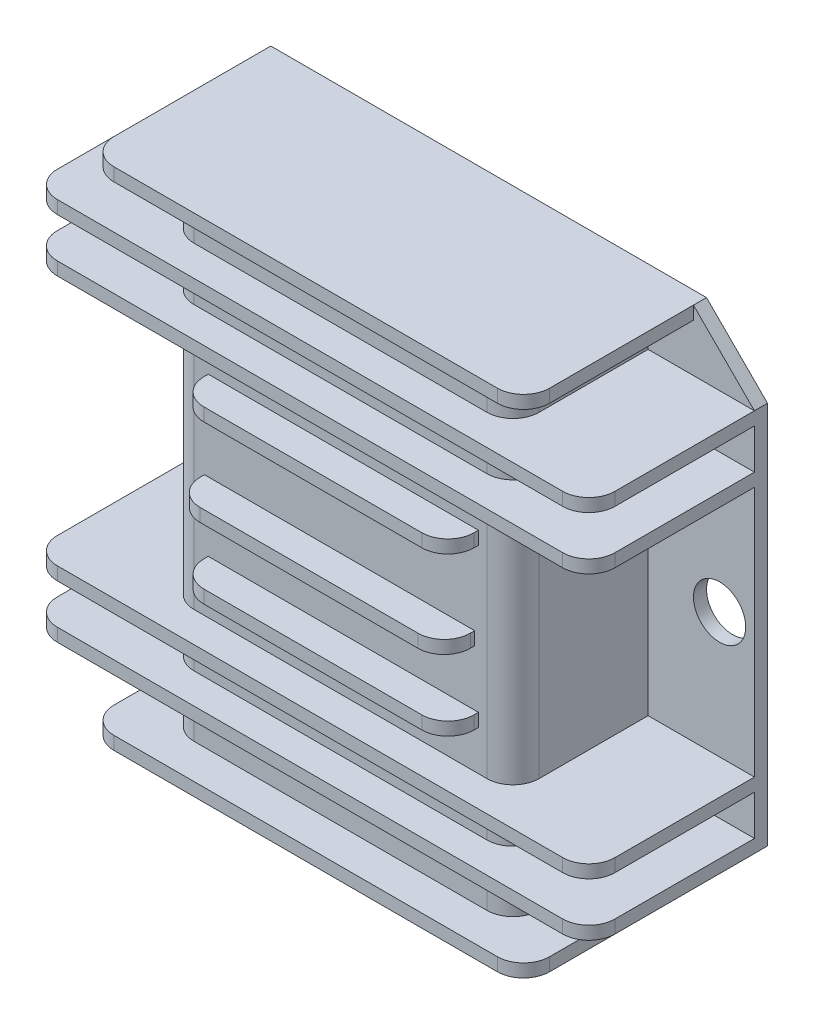
from build123d import *

# Parameters (mm, degrees)
SKETCH_1_W            = 64
SKETCH_1_H            = 58
EXTRUDE_1_DEPTH       = 20.5
SKETCH_2_W            = 19
SKETCH_2_H            = 4.6
CUT_EXTRUDE_1_DEPTH   = 74.193237393
SKETCH_3_W            = 19
SKETCH_3_H            = 28.8
CUT_EXTRUDE_2_DEPTH   = 74.193237393
SKETCH_4_W            = 19
SKETCH_4_H            = 4.6
CUT_EXTRUDE_3_DEPTH   = 74.193237393
SKETCH_5_W            = 19
SKETCH_5_H            = 7
CUT_EXTRUDE_4_DEPTH   = 74.193237393
SKETCH_6_W            = 19
SKETCH_6_H            = 7
CUT_EXTRUDE_5_DEPTH   = 74.193237393
SKETCH_7_W            = 39.6
SKETCH_7_H            = 15.5
EXTRUDE_2_DEPTH       = 28.8
SKETCH_8_W            = 50
SKETCH_8_H            = 1.5
EXTRUDE_3_DEPTH       = 19.5
SKETCH_9_W            = 50
SKETCH_9_H            = 1.5
EXTRUDE_4_DEPTH       = 19.5
SKETCH_10_W           = 31
SKETCH_10_H           = 1.5
EXTRUDE_5_DEPTH       = 3.5
SKETCH_11_W           = 31
SKETCH_11_H           = 1.5
EXTRUDE_6_DEPTH       = 3.5
SKETCH_12_W           = 31
SKETCH_12_H           = 1.5
EXTRUDE_7_DEPTH       = 3.5
HOLE_WIZARD_6_0_6_1_D = 6
RIB_1_REACH           = 50.021
SKETCH_15_WALL_W      = 103.541657628
SKETCH_15_WALL_H      = 39.6
RIB_2_REACH           = 50.021
SKETCH_16_WALL_W      = 103.541657628
SKETCH_16_WALL_H      = 39.6
RIB_3_REACH           = 50.021
SKETCH_17_WALL_W      = 102.641657628
SKETCH_17_WALL_H      = 39.6
RIB_4_REACH           = 50.021
SKETCH_18_WALL_W      = 102.641657628
SKETCH_18_WALL_H      = 39.6
CHAMFER_1_SIZE        = 7
FILLET_1_R            = 3


with BuildPart() as part:
    # 草图1 → 凸台-拉伸1 (new body)
    with BuildSketch(Plane(origin=(0, 0, 0), x_dir=(-1, 0, 0), z_dir=(0, 0, -1))):
        Rectangle(SKETCH_1_W, SKETCH_1_H)
    extrude(amount=-EXTRUDE_1_DEPTH)

    # 草图2 → 切除-拉伸1 (cut, through all)
    with BuildSketch(Plane(origin=(32, 0, 0), x_dir=(0, 0, -1), z_dir=(1, 0, 0))):
        with Locations((-11, -18.2)):
            Rectangle(SKETCH_2_W, SKETCH_2_H)
    extrude(amount=-CUT_EXTRUDE_1_DEPTH, mode=Mode.SUBTRACT)

    # 草图3 → 切除-拉伸2 (cut, through all)
    with BuildSketch(Plane(origin=(32, 0, 0), x_dir=(0, 0, -1), z_dir=(1, 0, 0))):
        with Locations((-11, 0)):
            Rectangle(SKETCH_3_W, SKETCH_3_H)
    extrude(amount=-CUT_EXTRUDE_2_DEPTH, mode=Mode.SUBTRACT)

    # 草图4 → 切除-拉伸3 (cut, through all)
    with BuildSketch(Plane(origin=(32, 0, 0), x_dir=(0, 0, -1), z_dir=(1, 0, 0))):
        with Locations((-11, 18.2)):
            Rectangle(SKETCH_4_W, SKETCH_4_H)
    extrude(amount=-CUT_EXTRUDE_3_DEPTH, mode=Mode.SUBTRACT)

    # 草图5 → 切除-拉伸4 (cut, through all)
    with BuildSketch(Plane(origin=(32, 0, 0), x_dir=(0, 0, -1), z_dir=(1, 0, 0))):
        with Locations((-11, 25.5)):
            Rectangle(SKETCH_5_W, SKETCH_5_H)
    extrude(amount=-CUT_EXTRUDE_4_DEPTH, mode=Mode.SUBTRACT)

    # 草图6 → 切除-拉伸5 (cut, through all)
    with BuildSketch(Plane(origin=(32, 0, 0), x_dir=(0, 0, -1), z_dir=(1, 0, 0))):
        with Locations((-11, -25.5)):
            Rectangle(SKETCH_6_W, SKETCH_6_H)
    extrude(amount=-CUT_EXTRUDE_5_DEPTH, mode=Mode.SUBTRACT)

    # 草图7 → 凸台-拉伸2 (add)
    with BuildSketch(Plane.XZ.offset(-14.4)):
        with Locations((0, 9.25)):
            Rectangle(SKETCH_7_W, SKETCH_7_H)
    extrude(amount=EXTRUDE_2_DEPTH)

    # 草图8 → 凸台-拉伸3 (add)
    with BuildSketch(Plane.XY.offset(1.5)):
        with Locations((0, -28.25)):
            Rectangle(SKETCH_8_W, SKETCH_8_H)
    extrude(amount=EXTRUDE_3_DEPTH)

    # 草图9 → 凸台-拉伸4 (add)
    with BuildSketch(Plane.XY.offset(1.5)):
        with Locations((0, 28.25)):
            Rectangle(SKETCH_9_W, SKETCH_9_H)
    extrude(amount=EXTRUDE_4_DEPTH)

    # 草图10 → 凸台-拉伸5 (add)
    with BuildSketch(Plane.XY.offset(17)):
        with Locations((0.330554393, 9.05)):
            Rectangle(SKETCH_10_W, SKETCH_10_H)
    extrude(amount=EXTRUDE_5_DEPTH)

    # 草图11 → 凸台-拉伸6 (add)
    with BuildSketch(Plane.XY.offset(17)):
        with Locations((-0.104926517, -1.15574974)):
            Rectangle(SKETCH_11_W, SKETCH_11_H)
    extrude(amount=EXTRUDE_6_DEPTH)

    # 草图12 → 凸台-拉伸7 (add)
    with BuildSketch(Plane.XY.offset(17)):
        with Locations((0.330554393, -9.05)):
            Rectangle(SKETCH_12_W, SKETCH_12_H)
    extrude(amount=EXTRUDE_7_DEPTH)

    # Ø6.0 (6) 直径孔1 (through all)
    with Locations(Plane.XY.offset(1.5)):
        with Locations((28, 0), (-28, 0)):
            Hole(HOLE_WIZARD_6_0_6_1_D / 2)

    # 草图15 wall → 筋1 (add, up to next)
    with BuildSketch(Plane(origin=(0, 24.75, 17), x_dir=(0, -1, 0), z_dir=(0, 0, -1)), mode=Mode.PRIVATE) as rib_1_sk1:
        Rectangle(SKETCH_15_WALL_W, SKETCH_15_WALL_H)
    rib_1_tool1 = extrude(rib_1_sk1.sketch, amount=RIB_1_REACH, mode=Mode.PRIVATE) - part.part
    add(rib_1_tool1.solids().sort_by_distance((0, 24.75, 17))[0])

    # 草图16 wall → 筋2 (add, up to next)
    with BuildSketch(Plane(origin=(0, -24.75, 17), x_dir=(0, 1, 0), z_dir=(0, 0, -1)), mode=Mode.PRIVATE) as rib_2_sk1:
        Rectangle(SKETCH_16_WALL_W, SKETCH_16_WALL_H)
    rib_2_tool1 = extrude(rib_2_sk1.sketch, amount=RIB_2_REACH, mode=Mode.PRIVATE) - part.part
    add(rib_2_tool1.solids().sort_by_distance((0, -24.75, 17))[0])

    # 草图17 wall → 筋3 (add, up to next)
    with BuildSketch(Plane(origin=(0, 18.2, 17), x_dir=(0, 1, 0), z_dir=(0, 0, -1)), mode=Mode.PRIVATE) as rib_3_sk1:
        Rectangle(SKETCH_17_WALL_W, SKETCH_17_WALL_H)
    rib_3_tool1 = extrude(rib_3_sk1.sketch, amount=RIB_3_REACH, mode=Mode.PRIVATE) - part.part
    add(rib_3_tool1.solids().sort_by_distance((0, 18.2, 17))[0])

    # 草图18 wall → 筋4 (add, up to next)
    with BuildSketch(Plane(origin=(0, -18.2, 17), x_dir=(0, -1, 0), z_dir=(0, 0, -1)), mode=Mode.PRIVATE) as rib_4_sk1:
        Rectangle(SKETCH_18_WALL_W, SKETCH_18_WALL_H)
    rib_4_tool1 = extrude(rib_4_sk1.sketch, amount=RIB_4_REACH, mode=Mode.PRIVATE) - part.part
    add(rib_4_tool1.solids().sort_by_distance((0, -18.2, 17))[0])

    # 倒角1
    chamfer_1_edges = [part.edges().sort_by_distance(p)[0] for p in [
        (-32, 29, 0.75),
        (-32, -29, 0.75),
        (32, 29, 0.75),
        (32, -29, 0.75),
    ]]
    chamfer(chamfer_1_edges, length=CHAMFER_1_SIZE)

    # 圆角1
    fillet_1_edges = [part.edges().sort_by_distance(p)[0] for p in [
        (19.8, 0, 17),
        (-19.8, 0, 17),
        (-25, -28.25, 21),
        (25, -28.25, 21),
        (-25, 28.25, 21),
        (25, 28.25, 21),
        (-15.169445607, 9.05, 20.5),
        (15.830554393, 9.05, 20.5),
        (-32, -15.15, 20.5),
        (32, -21.25, 20.5),
        (-15.604926517, -1.15574974, 20.5),
        (15.395073483, -1.15574974, 20.5),
        (-15.169445607, -9.05, 20.5),
        (15.830554393, -9.05, 20.5),
        (19.8, 24.75, 17),
        (-19.8, 24.75, 17),
        (19.8, -24.75, 17),
        (-19.8, -24.75, 17),
        (32, -15.15, 20.5),
        (-32, 15.15, 20.5),
        (-19.8, 18.2, 17),
        (19.8, 18.2, 17),
        (-19.8, -18.2, 17),
        (19.8, -18.2, 17),
        (32, 15.15, 20.5),
        (-32, 21.25, 20.5),
        (32, 21.25, 20.5),
        (-32, -21.25, 20.5),
    ]]
    fillet(fillet_1_edges, radius=FILLET_1_R)


solid = part.part
